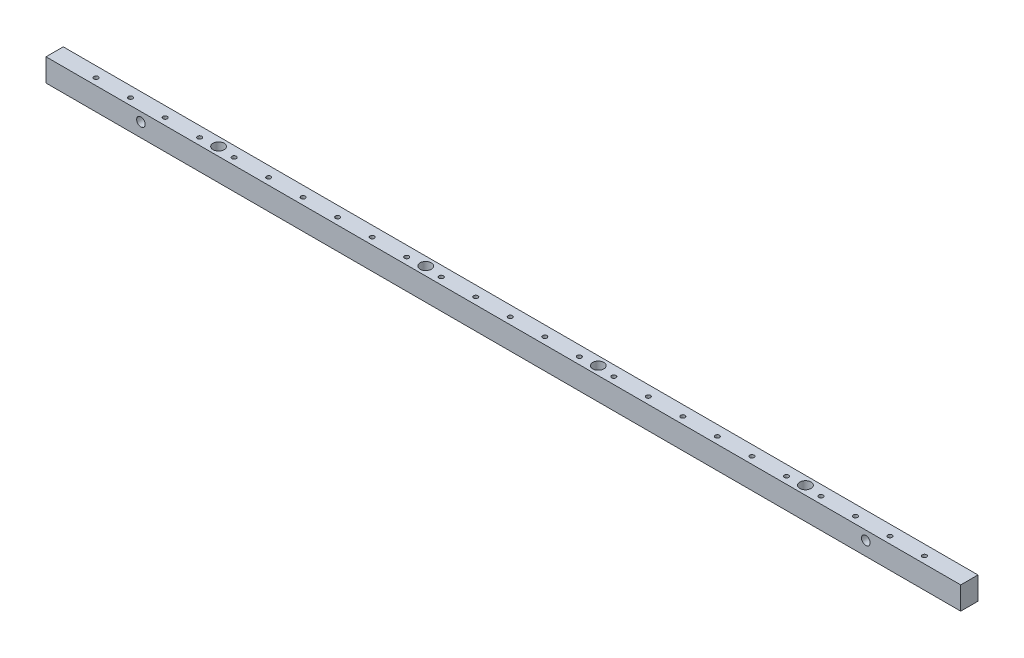
from build123d import *

# Parameters (mm, degrees)
SKETCH1_W                      = 530
SKETCH1_H                      = 10
BOSS_EXTRUDE1_DEPTH            = 13.2
M3X0_5_TAPPED_HOLE1_D          = 2.5
LPATTERN1_COUNT                = 13
LPATTERN1_PITCH                = 20
LPATTERN1_COL_COUNT            = 13
LPATTERN1_COL_PITCH            = 20
CBORE_FOR_M3_SHCS1_D           = 3.6
CBORE_FOR_M3_SHCS1_DEPTH       = 15
CBORE_FOR_M3_SHCS1_CBORE_D     = 6.5
CBORE_FOR_M3_SHCS1_CBORE_DEPTH = 5
CBORE_FOR_M3_SHCS1_TIP         = 1.081549114


with BuildPart() as part:
    # Sketch1 → Boss-Extrude1 (new body)
    with BuildSketch(Plane(origin=(0, 0, 0), x_dir=(1, 0, 0), z_dir=(0, 1, 0))):
        Rectangle(SKETCH1_W, SKETCH1_H)
    extrude(amount=BOSS_EXTRUDE1_DEPTH)

    # M3x0.5 Tapped Hole1 (through all)
    with Locations(Plane(origin=(0, 13.2, 1), x_dir=(0, 0, 1), z_dir=(0, 1, 0))):
        with Locations((0, 0)):
            m3x0_5_tapped_hole1 = Hole(M3X0_5_TAPPED_HOLE1_D / 2)

    # LPattern1: M3x0.5 Tapped Hole1 ×13
    with Locations(*[(i * LPATTERN1_PITCH, 0, 0) for i in range(1, LPATTERN1_COUNT)]):
        add(m3x0_5_tapped_hole1, mode=Mode.SUBTRACT)

    # LPattern1 col: M3x0.5 Tapped Hole1 ×13
    with Locations(*[(-i * LPATTERN1_COL_PITCH, 0, 0) for i in range(1, LPATTERN1_COL_COUNT)]):
        add(m3x0_5_tapped_hole1, mode=Mode.SUBTRACT)

    # Sketch6 → M6x1.0 Tapped Hole1 (revolve, cut)
    with BuildSketch(Plane(origin=(210, 8, 5), x_dir=(0, -1, 0), z_dir=(1, 0, 0))):
        Polygon((0, 0), (0, 16.502151548), (2.5, 15), (2.5, 0), align=None)
    m6x1_0_tapped_hole1 = revolve(axis=Axis((210, 8, 11.35), (0, 0, -1)), mode=Mode.SUBTRACT)

    # CBORE for M3 SHCS1
    with Locations(Plane(origin=(-170, 13.2, 0), x_dir=(0, 0, 1), z_dir=(0, 1, 0))):
        with Locations((0, 0), (0, 120), (0, 220), (0, 340)):
            CounterBoreHole(CBORE_FOR_M3_SHCS1_D / 2, CBORE_FOR_M3_SHCS1_CBORE_D / 2, CBORE_FOR_M3_SHCS1_CBORE_DEPTH, depth=CBORE_FOR_M3_SHCS1_DEPTH)
            with Locations((0, 0, -(CBORE_FOR_M3_SHCS1_DEPTH + CBORE_FOR_M3_SHCS1_TIP / 2))):  # 118° drill point
                Cone(0, CBORE_FOR_M3_SHCS1_D / 2, CBORE_FOR_M3_SHCS1_TIP, mode=Mode.SUBTRACT)

    # Mirror1: M6x1.0 Tapped Hole1 across plane
    add(m6x1_0_tapped_hole1.mirror(Plane(origin=(0, 0, 0), x_dir=(0, 0, 1), z_dir=(1, 0, 0))), mode=Mode.SUBTRACT)


solid = part.part
